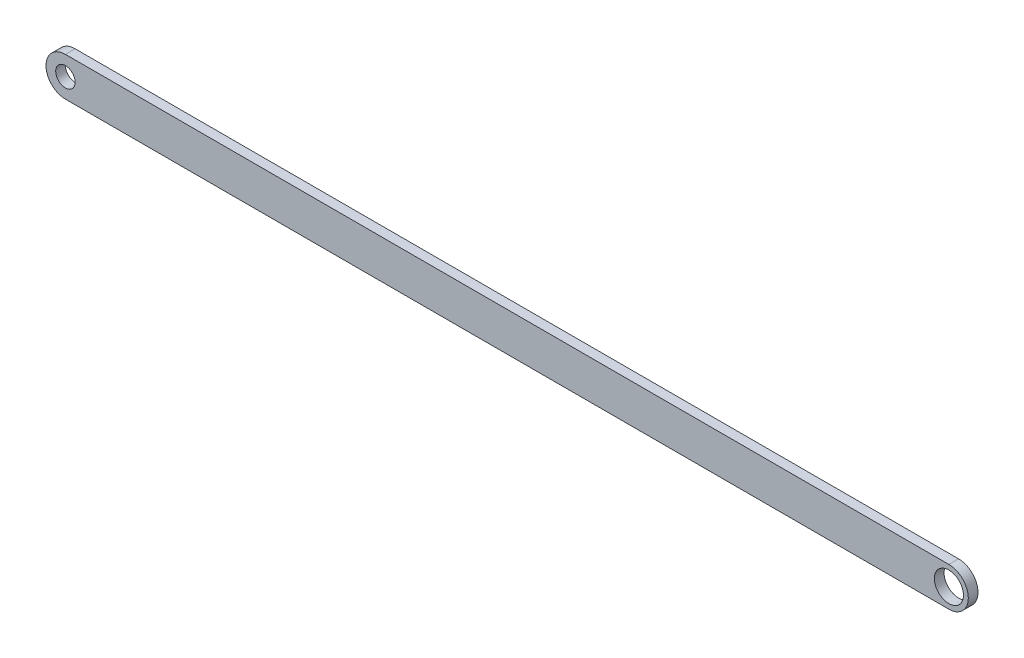
from build123d import *

# Parameters (mm, degrees)
ESBO_O1_R                = 1.5
ESBO_O1_R_2              = 1
RESSALTO_EXTRUS_O1_DEPTH = 1


with BuildPart() as part:
    # Esboço1 → Ressalto-extrusão1 (new body)
    with BuildSketch(Plane.XY):
        with BuildLine():
            Line((-45.545, 2), (45.545, 2))
            ThreePointArc((45.545, 2), (47.545, 0), (45.545, -2))
            Line((45.545, -2), (-45.545, -2))
            ThreePointArc((-45.545, -2), (-47.545, 0), (-45.545, 2))
        make_face()
        with Locations((45.545, 0)):
            Circle(ESBO_O1_R, mode=Mode.SUBTRACT)
        with Locations((-45.545, 0)):
            Circle(ESBO_O1_R_2, mode=Mode.SUBTRACT)
    extrude(amount=RESSALTO_EXTRUS_O1_DEPTH)


solid = part.part
